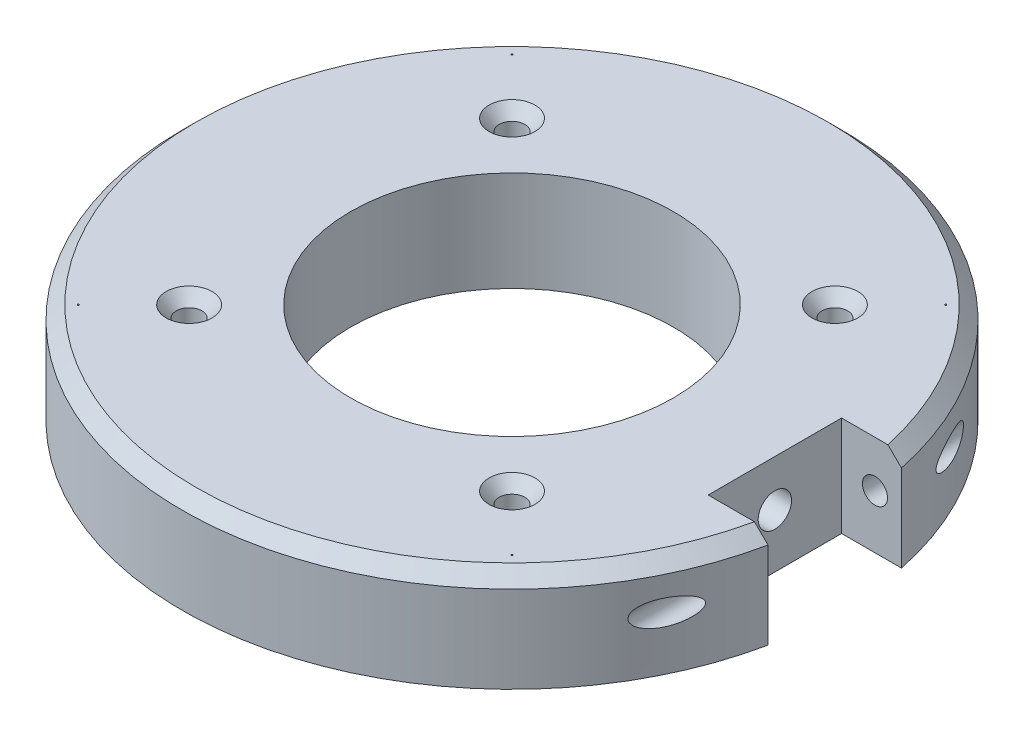
from build123d import *

# Parameters (mm, degrees)
SKETCH2_R                                         = 15.367
CUT_EXTRUDE1_DEPTH                                = 46.373493881
CSK_FOR_2_FLAT_HEAD_MACHINE_SCREW_100_D           = 2.4384
CSK_FOR_2_FLAT_HEAD_MACHINE_SCREW_100_CSINK_D     = 4.3688
CSK_FOR_2_FLAT_HEAD_MACHINE_SCREW_100_CSINK_ANGLE = 82
SKETCH8_W                                         = 6.35
SKETCH8_H                                         = 12.7
CUT_EXTRUDE2_DEPTH                                = 46.373493881
CUT_EXTRUDE3_DEPTH                                = 50.974621029
CUT_EXTRUDE3_DEPTH_BACK                           = 50.974621029
SKETCH14_R                                        = 1.1938
F_1_8_0_125_DIAMETER_HOLE1_D                      = 3.175
F_1_8_0_125_DIAMETER_HOLE1_DEPTH                  = 7.62
F_1_8_0_125_DIAMETER_HOLE1_TIP                    = 0.65756403
F_4_40_TAPPED_HOLE1_D                             = 2.2606
F_4_40_TAPPED_HOLE1_DEPTH                         = 8.89
F_4_40_TAPPED_HOLE1_CSINK_D                       = 3.175
F_4_40_TAPPED_HOLE1_CSINK_ANGLE                   = 90
F_4_40_TAPPED_HOLE1_TIP                           = 0.679152758


with BuildPart() as part:
    # Sketch1 → Revolve1 (revolve)
    with BuildSketch(Plane.XY):
        Polygon((0, 0), (31.369, 0), (31.369, 8.255), (30.099, 9.525), (0, 9.525), align=None)
    revolve(axis=Axis((0, 9.525, 0), (0, -1, 0)))

    # Sketch2 → Cut-Extrude1 (cut, through all)
    with BuildSketch(Plane.XZ):
        Circle(SKETCH2_R)
    extrude(amount=-CUT_EXTRUDE1_DEPTH, mode=Mode.SUBTRACT)

    # CSK for #2 Flat Head Machine Screw (100)1 (through all)
    with Locations(Plane(origin=(0, 9.525, 0), x_dir=(1, 0, 0), z_dir=(0, 1, 0))):
        with Locations((-15.367, 15.367), (15.367, 15.367), (15.367, -15.367), (-15.367, -15.367)):
            CounterSinkHole(CSK_FOR_2_FLAT_HEAD_MACHINE_SCREW_100_D / 2, CSK_FOR_2_FLAT_HEAD_MACHINE_SCREW_100_CSINK_D / 2, counter_sink_angle=CSK_FOR_2_FLAT_HEAD_MACHINE_SCREW_100_CSINK_ANGLE)

    # Sketch8 → Cut-Extrude2 (cut, through all)
    with BuildSketch(Plane(origin=(0, 9.525, 0), x_dir=(1, 0, 0), z_dir=(0, 1, 0))):
        with Locations((28.194, 0)):
            Rectangle(SKETCH8_W, SKETCH8_H)
    extrude(amount=-CUT_EXTRUDE2_DEPTH, mode=Mode.SUBTRACT)

    # Sketch14 → Cut-Extrude3 (cut, two sides: drawn at the far end of the back side and taken through both)
    with BuildSketch(Plane(origin=(0, 0, 6.35), x_dir=(-1, 0, 0), z_dir=(0, 0, -1)).offset(-CUT_EXTRUDE3_DEPTH_BACK)):
        with Locations((-28.194, 5.1181)):
            Circle(SKETCH14_R)
    extrude(amount=CUT_EXTRUDE3_DEPTH + CUT_EXTRUDE3_DEPTH_BACK, mode=Mode.SUBTRACT)

    # 1/8 (0.125) Diameter Hole1
    with Locations(Plane(origin=(25.019, 0, 0), x_dir=(0, 0, -1), z_dir=(1, 0, 0))):
        with Locations((0, 5.1181)):
            Hole(F_1_8_0_125_DIAMETER_HOLE1_D / 2, depth=F_1_8_0_125_DIAMETER_HOLE1_DEPTH)
            with Locations((0, 0, -(F_1_8_0_125_DIAMETER_HOLE1_DEPTH + F_1_8_0_125_DIAMETER_HOLE1_TIP / 2))):  # 135° drill point
                Cone(0, F_1_8_0_125_DIAMETER_HOLE1_D / 2, F_1_8_0_125_DIAMETER_HOLE1_TIP, mode=Mode.SUBTRACT)

    # #4-40 Tapped Hole1
    with Locations(Plane(origin=(0, 0, 0), x_dir=(-1, 0, 0), z_dir=(0, -1, 0))):
        with Locations((-20.6375, -20.6375), (-20.6375, 20.6375), (20.6375, 20.6375), (20.6375, -20.6375)):
            CounterSinkHole(F_4_40_TAPPED_HOLE1_D / 2, F_4_40_TAPPED_HOLE1_CSINK_D / 2, depth=F_4_40_TAPPED_HOLE1_DEPTH, counter_sink_angle=F_4_40_TAPPED_HOLE1_CSINK_ANGLE)
            with Locations((0, 0, -(F_4_40_TAPPED_HOLE1_DEPTH + F_4_40_TAPPED_HOLE1_TIP / 2))):  # 118° drill point
                Cone(0, F_4_40_TAPPED_HOLE1_D / 2, F_4_40_TAPPED_HOLE1_TIP, mode=Mode.SUBTRACT)


solid = part.part
